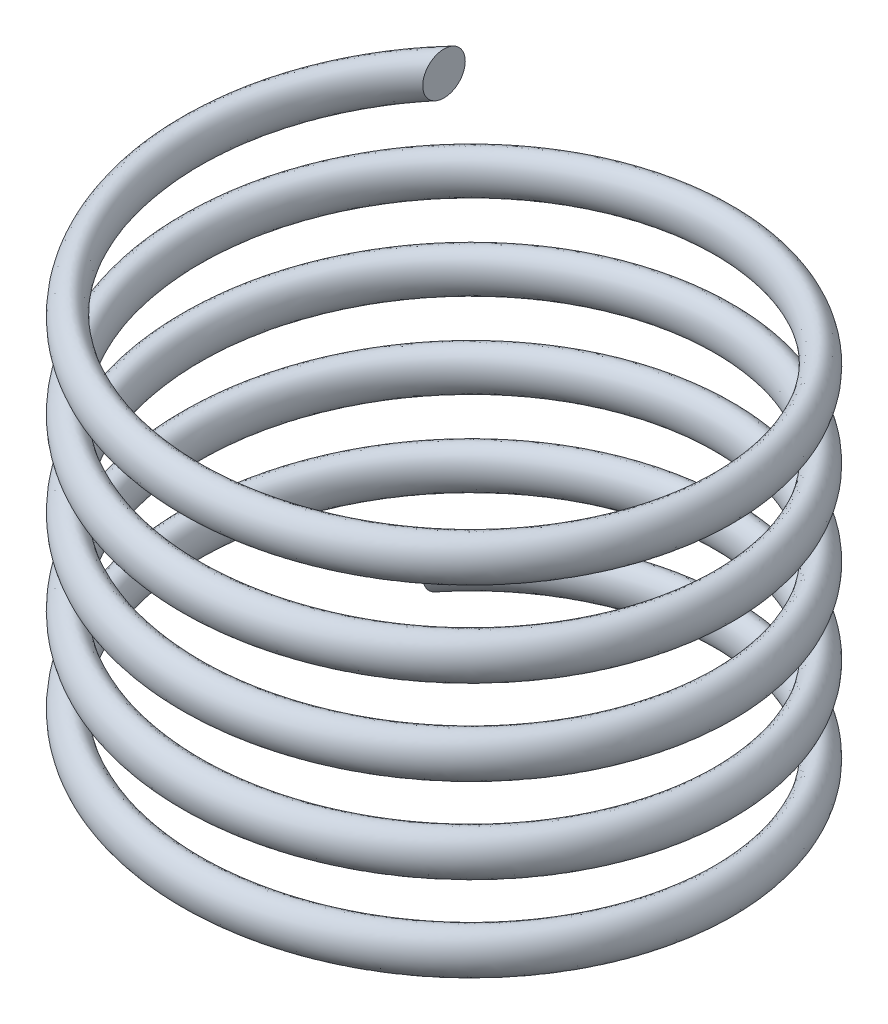
from build123d import *

# Parameters (mm, degrees)
SWEEP1_PITCH       = 8
SWEEP1_HEIGHT      = 40
SWEEP1_RADIUS      = 25
SWEEP1_START_ANGLE = -135
SKETCH4_R          = 2


with BuildPart() as part:
    # Sweep1: sweep along a helix
    with BuildLine() as sweep1_path:
        add(Helix(SWEEP1_PITCH, SWEEP1_HEIGHT, SWEEP1_RADIUS, center=(0, 0, 0), direction=(0, 1, 0), lefthand=True, mode=Mode.PRIVATE).rotate(Axis((0, 0, 0), (0, 1, 0)), SWEEP1_START_ANGLE))
    # Sketch4 → Sweep1 (sweep)
    with BuildSketch(Plane(origin=(-17.67766953, 0, 0), x_dir=(0, 0, -1), z_dir=(1, 0, 0))):
        with Locations((17.67766953, 0)):
            Circle(SKETCH4_R)
    sweep(path=sweep1_path.line, is_frenet=True)


solid = part.part
